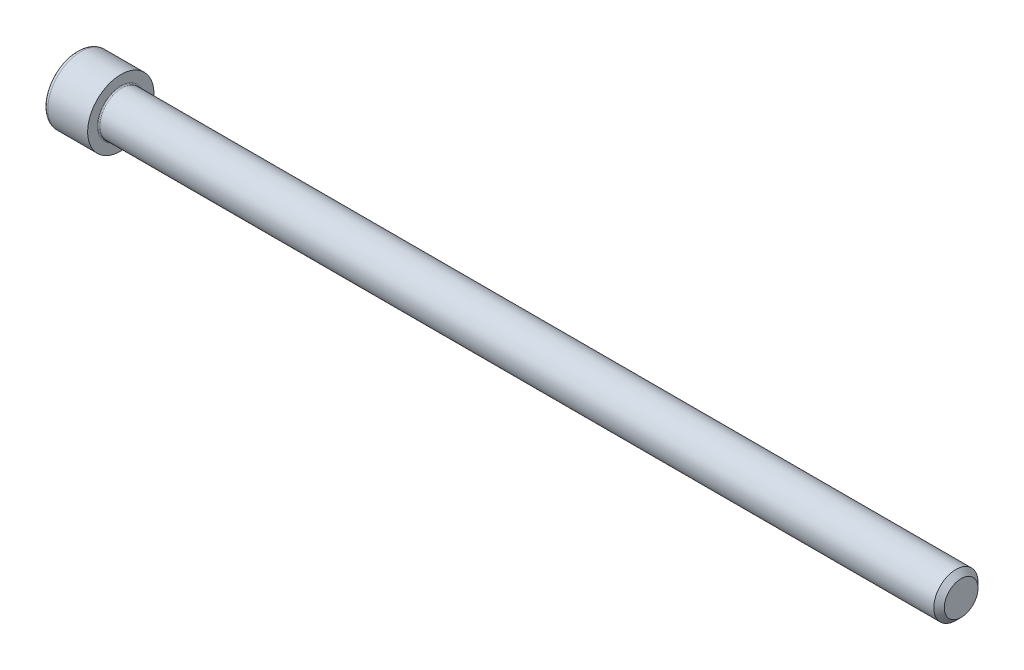
from build123d import *

# Parameters (mm, degrees)
SLOT_REACH    = 129.178
THREAD_R      = 0.635
CHAMFER1_SIZE = 0.75565
FILLET2_R     = 0.1778


with BuildPart() as part:
    # Sketch1 → Body (revolve)
    with BuildSketch(Plane.XY, mode=Mode.PRIVATE) as body_sk:
        Polygon((-1.710266667, 0), (120.65, 0), (120.65, 3.175), (88.9, 3.175), (85.7249, 3.175), (0, 3.175), (0, 4.7625), (-6.35, 4.7625), (-6.35, 2.756963005), (-3.302, 2.756963005), align=None)
    revolve(body_sk.sketch.rotate(Axis((-1.710266667, 0, 0), (1, 0, 0)), 180), axis=Axis((-1.710266667, 0, 0), (1, 0, 0)))

    # Slot: up to this cone (the profile starts inside it)
    slot_end = Plane(origin=(-6.35, 0, 0), z_dir=(-1, 0, 0)).offset(-4.639732333) * Cone(1.732e-06, 246.564338491, 142.3539862, align=(Align.CENTER, Align.CENTER, Align.MIN), mode=Mode.PRIVATE)
    # Sketch2 → Slot (add, up to the surface)
    with BuildSketch(Plane.ZY.offset(6.35), mode=Mode.PRIVATE) as slot_sk1:
        with BuildLine():
            ThreePointArc((1.378481503, -2.3876), (2.3876, -1.378481503), (2.756963005, 0))
            Line((2.756963005, 0), (1.378481503, -2.3876))
        make_face()
    slot_tool1 = extrude(slot_sk1.sketch, amount=-SLOT_REACH, mode=Mode.PRIVATE) & slot_end
    add(slot_tool1.solids().sort_by_distance((-6.35, -1.268114, 2.196438))[0])
    # Sketch2 → Slot (add, up to the surface)
    with BuildSketch(Plane.ZY.offset(6.35), mode=Mode.PRIVATE) as slot_sk2:
        with BuildLine():
            ThreePointArc((-1.378481503, -2.3876), (0, -2.756963005), (1.378481503, -2.3876))
            Line((1.378481503, -2.3876), (-1.378481503, -2.3876))
        make_face()
    slot_tool2 = extrude(slot_sk2.sketch, amount=-SLOT_REACH, mode=Mode.PRIVATE) & slot_end
    add(slot_tool2.solids().sort_by_distance((-6.35, -2.536228, 0))[0])
    # Sketch2 → Slot (add, up to the surface)
    with BuildSketch(Plane.ZY.offset(6.35), mode=Mode.PRIVATE) as slot_sk3:
        with BuildLine():
            ThreePointArc((-2.756963005, 0), (-2.3876, -1.378481503), (-1.378481503, -2.3876))
            Line((-1.378481503, -2.3876), (-2.756963005, 0))
        make_face()
    slot_tool3 = extrude(slot_sk3.sketch, amount=-SLOT_REACH, mode=Mode.PRIVATE) & slot_end
    add(slot_tool3.solids().sort_by_distance((-6.35, -1.268114, -2.196438))[0])
    # Sketch2 → Slot (add, up to the surface)
    with BuildSketch(Plane.ZY.offset(6.35), mode=Mode.PRIVATE) as slot_sk4:
        with BuildLine():
            Line((-2.756963005, 0), (-1.378481503, 2.3876))
            ThreePointArc((-1.378481503, 2.3876), (-2.3876, 1.378481503), (-2.756963005, 0))
        make_face()
    slot_tool4 = extrude(slot_sk4.sketch, amount=-SLOT_REACH, mode=Mode.PRIVATE) & slot_end
    add(slot_tool4.solids().sort_by_distance((-6.35, 1.268114, -2.196438))[0])
    # Sketch2 → Slot (add, up to the surface)
    with BuildSketch(Plane.ZY.offset(6.35), mode=Mode.PRIVATE) as slot_sk5:
        with BuildLine():
            Line((-1.378481503, 2.3876), (1.378481503, 2.3876))
            ThreePointArc((1.378481503, 2.3876), (0, 2.756963005), (-1.378481503, 2.3876))
        make_face()
    slot_tool5 = extrude(slot_sk5.sketch, amount=-SLOT_REACH, mode=Mode.PRIVATE) & slot_end
    add(slot_tool5.solids().sort_by_distance((-6.35, 2.536228, 0))[0])
    # Sketch2 → Slot (add, up to the surface)
    with BuildSketch(Plane.ZY.offset(6.35), mode=Mode.PRIVATE) as slot_sk6:
        with BuildLine():
            Line((1.378481503, 2.3876), (2.756963005, 0))
            ThreePointArc((2.756963005, 0), (2.3876, 1.378481503), (1.378481503, 2.3876))
        make_face()
    slot_tool6 = extrude(slot_sk6.sketch, amount=-SLOT_REACH, mode=Mode.PRIVATE) & slot_end
    add(slot_tool6.solids().sort_by_distance((-6.35, 1.268114, 2.196438))[0])

    # Thread
    thread_edges = [part.edges().sort_by_distance(p)[0] for p in [
        (-6.35, 4.7625, 0),
    ]]
    fillet(thread_edges, radius=THREAD_R)

    # Chamfer1
    chamfer1_edges = [part.edges().sort_by_distance(p)[0] for p in [
        (120.65, 3.175, 0),
    ]]
    chamfer(chamfer1_edges, length=CHAMFER1_SIZE)

    # Fillet2
    fillet2_edges = [part.edges().sort_by_distance(p)[0] for p in [
        (0, 3.175, 0),
    ]]
    fillet(fillet2_edges, radius=FILLET2_R)


solid = part.part
